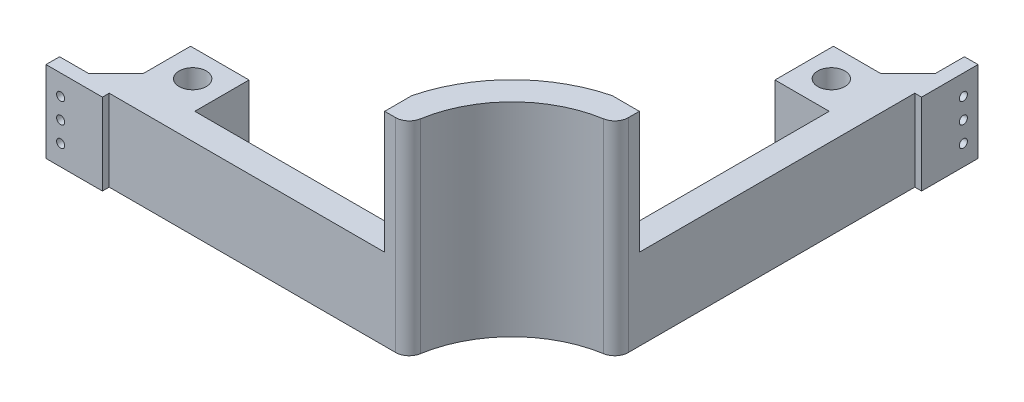
from build123d import *

# Parameters (mm, degrees)
SKETCH2_R           = 5
BOSS_EXTRUDE1_DEPTH = 30
SKETCH10_R          = 1.5
CUT_EXTRUDE1_DEPTH  = 10
SKETCH11_R          = 1.5
CUT_EXTRUDE3_DEPTH  = 10
BOSS_EXTRUDE2_DEPTH = 45


with BuildPart() as part:
    # Sketch2 → Boss-Extrude1 (new body)
    with BuildSketch(Plane(origin=(0, 0, 0), x_dir=(1, 0, 0), z_dir=(0, 1, 0))):
        with BuildLine():
            Line((-2.5, 45.384468709), (-2.5, 49.444413233))
            Line((-2.5, 49.444413233), (-2.5, 151))
            Line((-2.5, 151), (0, 151))
            Line((0, 151), (0, 171.795711314))
            Line((0, 171.795711314), (-5, 171.795711314))
            Line((-5, 171.795711314), (-5, 161))
            Line((-5, 161), (-15, 151))
            Line((-15, 151), (-32.5, 151))
            Line((-32.5, 151), (-32.5, 129.444413233))
            Line((-32.5, 129.444413233), (-12.5, 129.444413233))
            Line((-12.5, 129.444413233), (-12.5, 49.444413233))
            ThreePointArc((-12.5, 49.444413233), (-36.062445841, 36.062445841), (-49.444413233, 12.5))
            Line((-49.444413233, 12.5), (-129.444413233, 12.5))
            Line((-129.444413233, 12.5), (-129.444413233, 32.5))
            Line((-129.444413233, 32.5), (-151, 32.5))
            Line((-151, 32.5), (-151, 15))
            Line((-151, 15), (-161, 5))
            Line((-161, 5), (-171.795711314, 5))
            Line((-171.795711314, 5), (-171.795711314, 0))
            Line((-171.795711314, 0), (-151, 0))
            Line((-151, 0), (-151, 2.5))
            Line((-151, 2.5), (-49.444413233, 2.5))
            Line((-49.444413233, 2.5), (-45.384468709, 2.5))
            ThreePointArc((-45.384468709, 2.5), (-42.149973923, 3.687121366), (-40.451374284, 6.684782609))
            ThreePointArc((-40.451374284, 6.684782609), (-28.991378029, 28.991378029), (-6.684782609, 40.451374284))
            ThreePointArc((-6.684782609, 40.451374284), (-3.687121366, 42.149973923), (-2.5, 45.384468709))
        make_face()
        with Locations(Location((-22.5, 140.222206617, 0), (0, 0, 270))):
            Circle(SKETCH2_R, mode=Mode.SUBTRACT)
        with Locations(Location((-140.222206617, 22.5, 0), (0, 0, 270))):
            Circle(SKETCH2_R, mode=Mode.SUBTRACT)
    extrude(amount=BOSS_EXTRUDE1_DEPTH)

    # Sketch10 → Cut-Extrude1 (cut)
    with BuildSketch(Plane.ZY.offset(5)):
        with Locations((-166.397855657, 22.5)):
            Circle(SKETCH10_R)
        with Locations((-166.397855657, 15)):
            Circle(SKETCH10_R)
        with Locations((-166.397855657, 7.5)):
            Circle(SKETCH10_R)
    extrude(amount=-CUT_EXTRUDE1_DEPTH, mode=Mode.SUBTRACT)

    # Sketch11 → Cut-Extrude3 (cut)
    with BuildSketch(Plane(origin=(0, 0, -5), x_dir=(-1, 0, 0), z_dir=(0, 0, -1))):
        with Locations((166.397855657, 22.5)):
            Circle(SKETCH11_R)
        with Locations((166.397855657, 15)):
            Circle(SKETCH11_R)
        with Locations((166.397855657, 7.5)):
            Circle(SKETCH11_R)
    extrude(amount=-CUT_EXTRUDE3_DEPTH, mode=Mode.SUBTRACT)

    # Sketch13 → Boss-Extrude2 (add)
    with BuildSketch(Plane(origin=(0, 30, 0), x_dir=(1, 0, 0), z_dir=(0, 1, 0))):
        with BuildLine():
            Line((-49.444413233, 12.5), (-49.444413233, 2.5))
            Line((-49.444413233, 2.5), (-45.384468709, 2.5))
            ThreePointArc((-45.384468709, 2.5), (-42.149973923, 3.687121366), (-40.451374284, 6.684782609))
            ThreePointArc((-40.451374284, 6.684782609), (-28.991378029, 28.991378029), (-6.684782609, 40.451374284))
            ThreePointArc((-6.684782609, 40.451374284), (-3.687121366, 42.149973923), (-2.5, 45.384468709))
            Line((-2.5, 45.384468709), (-2.5, 49.444413233))
            Line((-2.5, 49.444413233), (-12.5, 49.444413233))
            ThreePointArc((-12.5, 49.444413233), (-36.062445841, 36.062445841), (-49.444413233, 12.5))
        make_face()
    extrude(amount=BOSS_EXTRUDE2_DEPTH)


solid = part.part
